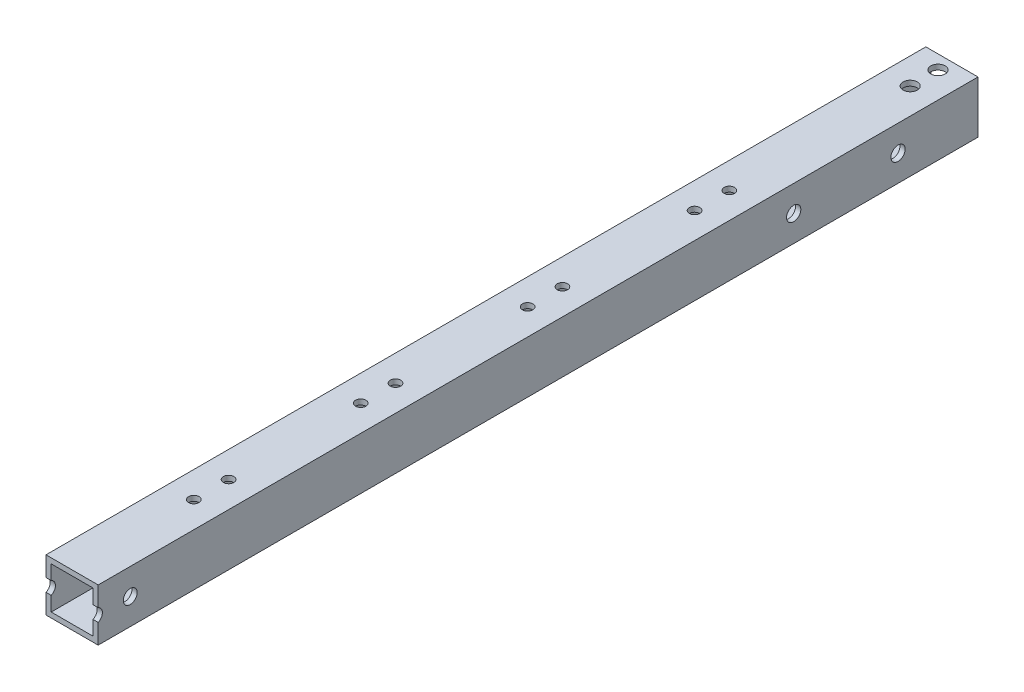
from build123d import *

# Parameters (mm, degrees)
SKETCH_1_W          = 15
SKETCH_1_H          = 15
SKETCH_1_W_2        = 12
SKETCH_1_H_2        = 12
EXTRUDE_1_DEPTH     = 375
SKETCH_3_R          = 2.05
CUT_EXTRUDE_2_DEPTH = 21
SKETCH_4_R          = 2.05
CUT_EXTRUDE_3_DEPTH = 25
SKETCH_6_R          = 2
CUT_EXTRUDE_5_DEPTH = 75
SKETCH_7_R          = 2
CUT_EXTRUDE_6_DEPTH = 376.374812687
SKETCH_8_W          = 122
SKETCH_8_H          = 15
CUT_EXTRUDE_7_DEPTH = 376.374812687
SKETCH_9_R          = 1.5
CUT_EXTRUDE_8_DEPTH = 254.55522081


with BuildPart() as part:
    # 草图1 → 凸台-拉伸1 (new body)
    with BuildSketch(Plane.XY):
        Rectangle(SKETCH_1_W, SKETCH_1_H)
        Rectangle(SKETCH_1_W_2, SKETCH_1_H_2, mode=Mode.SUBTRACT)
    extrude(amount=EXTRUDE_1_DEPTH)

    # 草图3 → 切除-拉伸2 (cut)
    with BuildSketch(Plane(origin=(0, 7.5, 0), x_dir=(1, 0, 0), z_dir=(0, 1, 0))):
        with Locations(Location((0, -4, 0), (0, 0, 270))):
            Circle(SKETCH_3_R)
        with Locations(Location((0, -12, 0), (0, 0, 270))):
            Circle(SKETCH_3_R)
    extrude(amount=-CUT_EXTRUDE_2_DEPTH, mode=Mode.SUBTRACT)

    # 草图4 → 切除-拉伸3 (cut)
    with BuildSketch(Plane(origin=(7.5, 0, 0), x_dir=(0, 0, -1), z_dir=(1, 0, 0))):
        with Locations((-23, 0)):
            Circle(SKETCH_4_R)
        with Locations((-53, 0)):
            Circle(SKETCH_4_R)
    extrude(amount=-CUT_EXTRUDE_3_DEPTH, mode=Mode.SUBTRACT)

    # 草图6 → 切除-拉伸5 (cut)
    with BuildSketch(Plane(origin=(0, 7.5, 0), x_dir=(1, 0, 0), z_dir=(0, 1, 0))):
        with Locations(Location((0, -335, 0), (0, 0, 270))):
            Circle(SKETCH_6_R)
        with Locations(Location((0, -350, 0), (0, 0, 270))):
            Circle(SKETCH_6_R)
    extrude(amount=-CUT_EXTRUDE_5_DEPTH, mode=Mode.SUBTRACT)

    # 草图7 → 切除-拉伸6 (cut, through all)
    with BuildSketch(Plane(origin=(7.5, 0, 0), x_dir=(0, 0, -1), z_dir=(1, 0, 0))):
        with Locations((-253.786796565, 0)):
            Circle(SKETCH_7_R)
        with Locations((-243.786796565, 0)):
            Circle(SKETCH_7_R)
    extrude(amount=-CUT_EXTRUDE_6_DEPTH, mode=Mode.SUBTRACT)

    # 草图8 → 切除-拉伸7 (cut, through all)
    with BuildSketch(Plane(origin=(7.5, 0, 0), x_dir=(0, 0, -1), z_dir=(1, 0, 0))):
        with Locations((-314, 0)):
            Rectangle(SKETCH_8_W, SKETCH_8_H)
    extrude(amount=-CUT_EXTRUDE_7_DEPTH, mode=Mode.SUBTRACT)

    # 草图9 → 切除-拉伸8 (cut, through all)
    with BuildSketch(Plane(origin=(0, 7.5, 0), x_dir=(1, 0, 0), z_dir=(0, 1, 0))):
        with Locations(Location((0, -218, 0), (0, 0, 270))):
            Circle(SKETCH_9_R)
        with Locations(Location((0, -208, 0), (0, 0, 270))):
            Circle(SKETCH_9_R)
        with Locations(Location((0, -170, 0), (0, 0, 270))):
            Circle(SKETCH_9_R)
        with Locations(Location((0, -160, 0), (0, 0, 270))):
            Circle(SKETCH_9_R)
        with Locations(Location((0, -122, 0), (0, 0, 270))):
            Circle(SKETCH_9_R)
        with Locations(Location((0, -112, 0), (0, 0, 270))):
            Circle(SKETCH_9_R)
        with Locations(Location((0, -74, 0), (0, 0, 270))):
            Circle(SKETCH_9_R)
        with Locations(Location((0, -64, 0), (0, 0, 270))):
            Circle(SKETCH_9_R)
    extrude(amount=-CUT_EXTRUDE_8_DEPTH, mode=Mode.SUBTRACT)


solid = part.part
